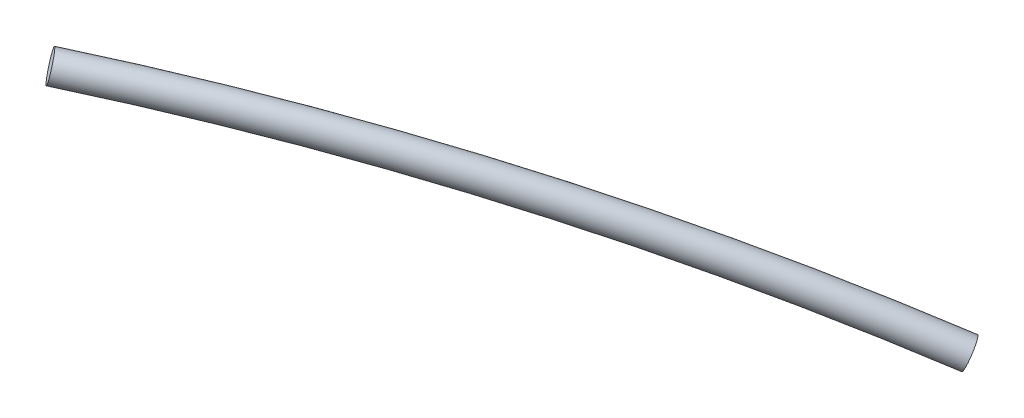
from build123d import *

# Parameters (mm, degrees)
SKETCH2_R = 50.8


with BuildPart() as part:
    # Sweep1: sweep along a path in Sketch1
    with BuildLine(Plane(origin=(-4086.383481233, -2369.858396088, -3771.771559598), x_dir=(0.539756739106947, 0.3130266764957875, -0.7814582281802636), z_dir=(0.6760032597217907, 0.392041522336793, 0.6239575607438083))) as sweep1_path:
        ThreePointArc((13843.18808764, 2415.522064159), (14828.644823202, 1698.528519634), (15737.414205906, 886.529178739))
    # Sketch2 → Sweep1 (sweep)
    with BuildSketch(Plane(origin=(7456.200783007, -2168.576607043, -6715.591289781), x_dir=(-0.6281131498914002, 0.18268170655153057, -0.7563737601377535), z_dir=(0.7262795878545545, -0.21123263311037527, -0.6541396907198617))):
        with Locations((10410.267939115, 4498.791303286)):
            Circle(SKETCH2_R)
    sweep(path=sweep1_path.line)


solid = part.part
